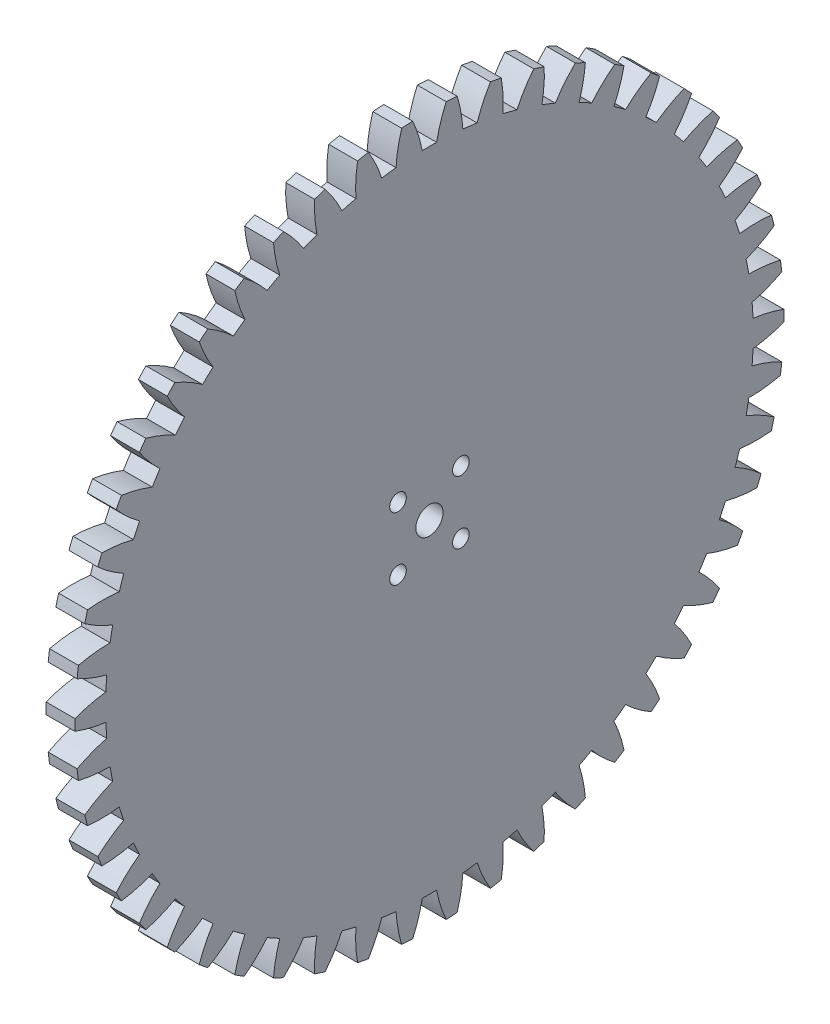
from build123d import *

# Parameters (mm, degrees)
BASPROSKE_W                  = 6.35
BASPROSKE_H                  = 78
TOOTHCUT_DEPTH               = 111.491277936
TEETHCUTS_COUNT              = 50
BORSKE_R                     = 3
BORE_DEPTH                   = 50.000254
ENL_V_MAT_EXTRU_1_REACH      = 112.43
ESQUISSE1_R                  = 1.83
R_P_TITION_CIRCULAIRE1_COUNT = 4


with BuildPart() as part:
    # BasProSke → Base-Revolve (revolve)
    with BuildSketch(Plane(origin=(0, 0, 0), x_dir=(1, 0, 0), z_dir=(0, 1, 0)), mode=Mode.PRIVATE) as base_revolve_sk:
        with Locations((3.175, 39)):
            Rectangle(BASPROSKE_W, BASPROSKE_H)
    revolve(base_revolve_sk.sketch.rotate(Axis((-10, 0, 0), (1, 0, 0)), 180), axis=Axis((-10, 0, 0), (1, 0, 0)))

    # TooCutSke → ToothCut (cut, through all)
    with BuildSketch(Plane(origin=(0, 0, 0), x_dir=(0, 0, -1), z_dir=(1, 0, 0))):
        with BuildLine():
            ThreePointArc((1.584443832, 71.231380295), (0, 71.249), (-1.584443832, 71.231380295))
            ThreePointArc((-1.584443832, 71.231380295), (-2.443481522, 74.646676615), (-3.696827947, 77.937773309))
            ThreePointArc((-3.696827947, 77.937773309), (0, 78.0254), (3.696827947, 77.937773309))
            ThreePointArc((3.696827947, 77.937773309), (2.443481522, 74.646676615), (1.584443832, 71.231380295))
        make_face()
    toothcut = extrude(amount=TOOTHCUT_DEPTH, mode=Mode.SUBTRACT)

    # TeethCuts: ToothCut ×50 about axis
    teethcuts_axis = Axis((0, 0, 0), (1, 0, 0))
    for i in range(1, TEETHCUTS_COUNT):
        add(toothcut.rotate(teethcuts_axis, i * 360 / TEETHCUTS_COUNT), mode=Mode.SUBTRACT)

    # BorSke → Bore (cut, symmetric)
    with BuildSketch(Plane(origin=(0, 0, 0), x_dir=(0, 0, -1), z_dir=(1, 0, 0))):
        with Locations(Location((0, 0, 0), (0, 0, 180))):
            Circle(BORSKE_R)
    extrude(amount=BORE_DEPTH, both=True, mode=Mode.SUBTRACT)

    # Esquisse1 → Enlèv. mat.-Extru.1 (cut, up to next)
    with BuildSketch(Plane.ZY, mode=Mode.PRIVATE) as enl_v_mat_extru_1_sk1:
        with Locations((6.914797213, 6.914797213)):
            Circle(ESQUISSE1_R)
    enl_v_mat_extru_1_tool1 = extrude(enl_v_mat_extru_1_sk1.sketch, amount=-ENL_V_MAT_EXTRU_1_REACH, mode=Mode.PRIVATE) & part.part
    enl_v_mat_extru_1 = enl_v_mat_extru_1_tool1.solids().sort_by_distance((0, 6.914797, 6.914797))[0]
    add(enl_v_mat_extru_1, mode=Mode.SUBTRACT)

    # Répétition circulaire1: Enlèv. mat.-Extru.1 ×4 about axis
    r_p_tition_circulaire1_axis = Axis((0, 0, 0), (1, 0, 0))
    for i in range(1, R_P_TITION_CIRCULAIRE1_COUNT):
        add(enl_v_mat_extru_1.rotate(r_p_tition_circulaire1_axis, i * 360 / R_P_TITION_CIRCULAIRE1_COUNT), mode=Mode.SUBTRACT)


solid = part.part
